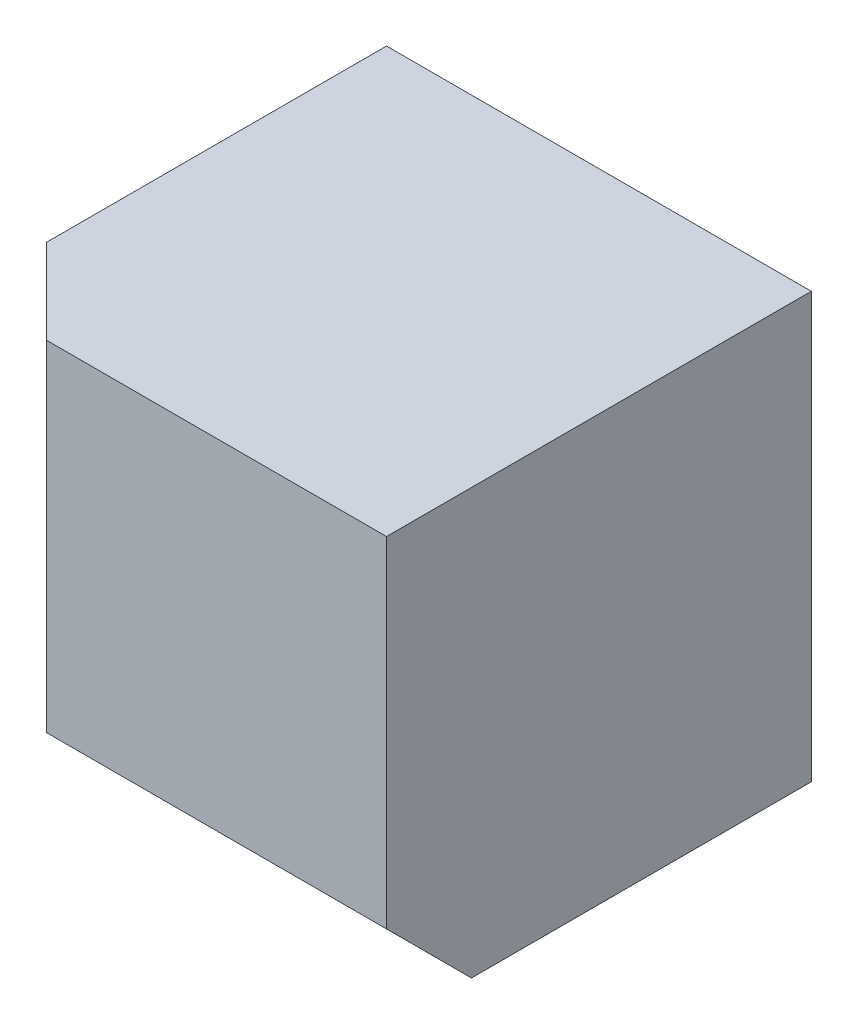
from build123d import *

# Parameters (mm, degrees)
SKETCH1_W           = 10
SKETCH1_H           = 10
BOSS_EXTRUDE1_DEPTH = 10
CHAMFER1_SIZE       = 2


with BuildPart() as part:
    # Sketch1 → Boss-Extrude1 (new body)
    with BuildSketch(Plane.XY):
        Rectangle(SKETCH1_W, SKETCH1_H)
    extrude(amount=BOSS_EXTRUDE1_DEPTH)

    # Chamfer1
    chamfer1_edges = [part.edges().sort_by_distance(p)[0] for p in [
        (0, -5, 10),
        (-5, 0, 10),
    ]]
    chamfer(chamfer1_edges, length=CHAMFER1_SIZE)


solid = part.part
